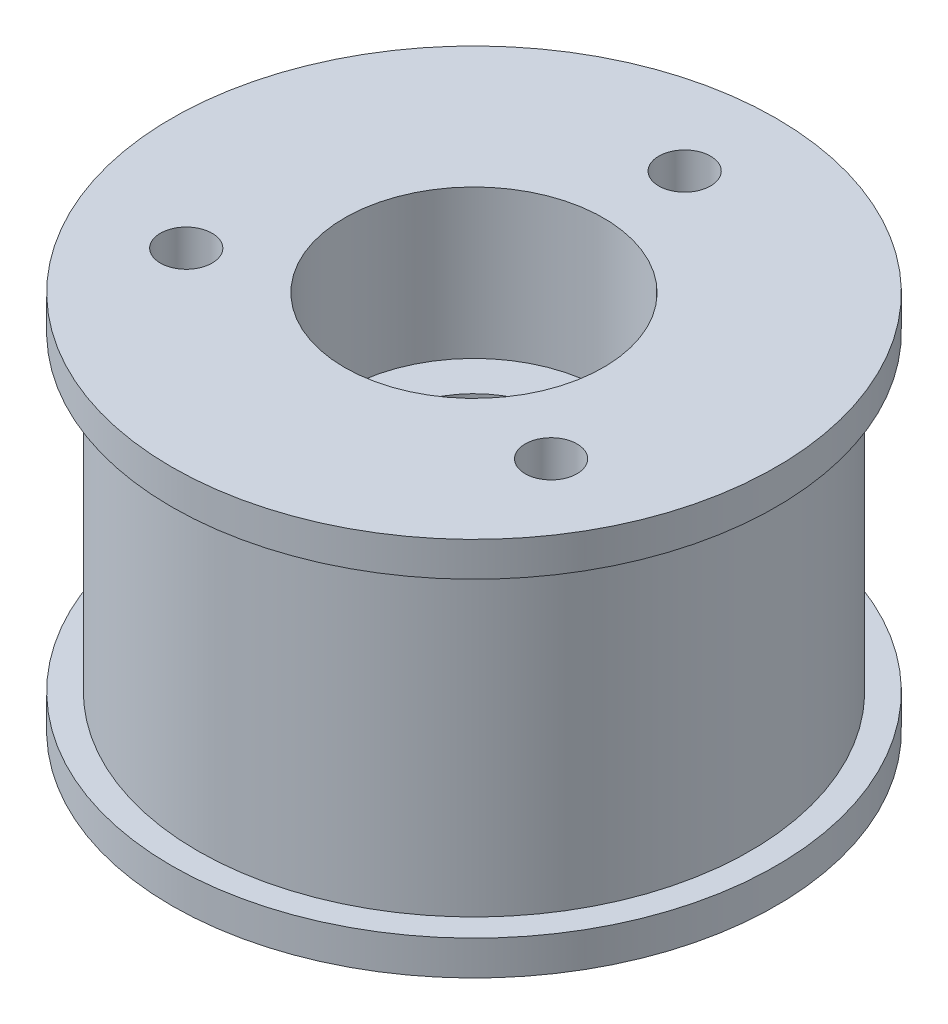
from build123d import *

# Parameters (mm, degrees)
SKETCH1_R                                           = 17.5
BOSS_EXTRUDE1_DEPTH                                 = 22
CBORE_FOR_M8_HEX_SOCKET_HEAD_CAP_SCREW1_D           = 10
CBORE_FOR_M8_HEX_SOCKET_HEAD_CAP_SCREW1_CBORE_D     = 15
CBORE_FOR_M8_HEX_SOCKET_HEAD_CAP_SCREW1_CBORE_DEPTH = 8.6
F_3_0MM_DOWEL_HOLE1_D                               = 3
SKETCH6_R                                           = 8.5
CUT_EXTRUDE1_DEPTH                                  = 3.5
CUT_EXTRUDE2_START                                  = -2
SKETCH7_R                                           = 17.5
SKETCH7_R_2                                         = 16
CUT_EXTRUDE2_DEPTH                                  = 18


with BuildPart() as part:
    # Sketch1 → Boss-Extrude1 (new body)
    with BuildSketch(Plane(origin=(0, 0, 0), x_dir=(1, 0, 0), z_dir=(0, 1, 0))):
        with Locations(Location((0, 0, 0), (0, 0, 270))):
            Circle(SKETCH1_R)
    extrude(amount=BOSS_EXTRUDE1_DEPTH)

    # CBORE for M8 Hex Socket Head Cap Screw1 (through all)
    with Locations(Plane(origin=(0, 22, 0), x_dir=(1, 0, 0), z_dir=(0, 1, 0))):
        with Locations((0, 0)):
            CounterBoreHole(CBORE_FOR_M8_HEX_SOCKET_HEAD_CAP_SCREW1_D / 2, CBORE_FOR_M8_HEX_SOCKET_HEAD_CAP_SCREW1_CBORE_D / 2, CBORE_FOR_M8_HEX_SOCKET_HEAD_CAP_SCREW1_CBORE_DEPTH)

    # Ø3.0mm Dowel Hole1 (through all)
    with Locations(Plane(origin=(0, 22, 0), x_dir=(1, 0, 0), z_dir=(0, 1, 0))):
        with Locations((-10.565509926, -6.1), (0, 12.2), (10.565509926, -6.1)):
            Hole(F_3_0MM_DOWEL_HOLE1_D / 2)

    # Sketch6 → Cut-Extrude1 (cut)
    with BuildSketch(Plane.XZ):
        with Locations(Location((0, 0, 0), (0, 0, 270))):
            Circle(SKETCH6_R)
    extrude(amount=-CUT_EXTRUDE1_DEPTH, mode=Mode.SUBTRACT)

    # Sketch7 → Cut-Extrude2 (cut)
    with BuildSketch(Plane.XZ.offset(CUT_EXTRUDE2_START)):
        with Locations(Location((0, 0, 0), (0, 0, 270))):
            Circle(SKETCH7_R)
        with Locations(Location((0, 0, 0), (0, 0, 270))):
            Circle(SKETCH7_R_2, mode=Mode.SUBTRACT)
    extrude(amount=-CUT_EXTRUDE2_DEPTH, mode=Mode.SUBTRACT)


solid = part.part
